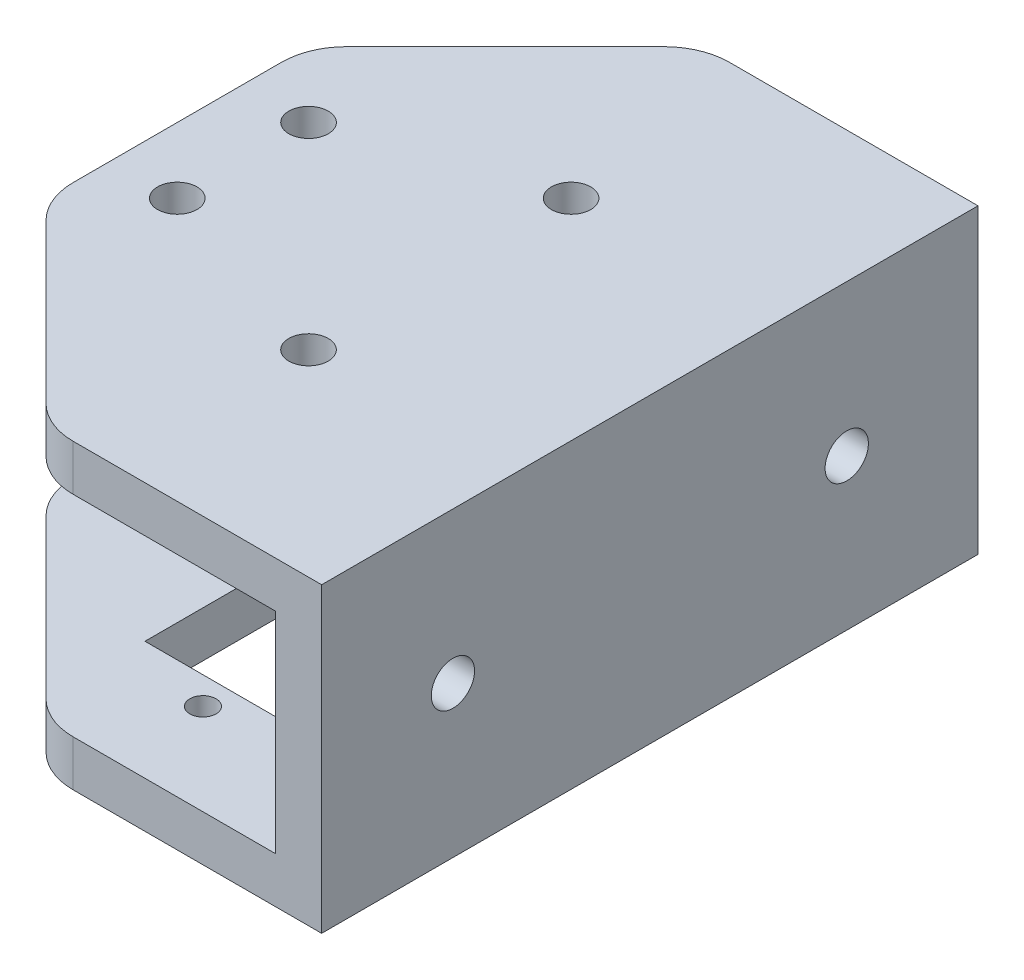
from build123d import *

# Parameters (mm, degrees)
EXTRUDE_1_DEPTH     = 50
CUT_EXTRUDE_START   = -19.5
SKETCH_2_R          = 1.5
CUT_EXTRUDE_1_DEPTH = 70
SKETCH_3_OUTSIDE_W  = 61.218
SKETCH_3_OUTSIDE_H  = 66.218
CUT_EXTRUDE_2_DEPTH = 70
SKETCH_2_3_R        = 1.5
CUT_EXTRUDE_4_DEPTH = 10
SKETCH_5_R          = 1
CUT_EXTRUDE_5_DEPTH = 10
FILLET_1_R          = 5
SKETCH_6_W          = 13
SKETCH_6_H          = 23.5
CUT_EXTRUDE_6_DEPTH = 10
SKETCH_7_R          = 1.65
CUT_EXTRUDE_7_DEPTH = 10


with BuildPart() as part:
    # 草图1 → 凸台-拉伸1 (new body)
    with BuildSketch(Plane.XY):
        Polygon((-45, 11.5), (0, 11.5), (0, -11.5), (-45, -11.5), (-45, -8), (-3.5, -8), (-3.5, 8), (-45, 8), align=None)
    extrude(amount=EXTRUDE_1_DEPTH)

    # 草图2 → 切除-拉伸1 (cut)
    with BuildSketch(Plane.XZ.offset(11.5).offset(CUT_EXTRUDE_START)):
        with Locations(Location((-16, 35, 0), (0, 0, 270))):
            Circle(SKETCH_2_R)
        with Locations(Location((-16, 15, 0), (0, 0, 270))):
            Circle(SKETCH_2_R)
        with Locations(Location((-31, 30, 0), (0, 0, 270))):
            Circle(SKETCH_2_R)
        with Locations(Location((-31, 20, 0), (0, 0, 270))):
            Circle(SKETCH_2_R)
    extrude(amount=-CUT_EXTRUDE_1_DEPTH, mode=Mode.SUBTRACT)

    # 草图3 outside → 切除-拉伸2 (cut)
    with BuildSketch(Plane.XZ.offset(11.5)):
        with Locations((-22.5, 25)):
            Rectangle(SKETCH_3_OUTSIDE_W, SKETCH_3_OUTSIDE_H)
        Polygon((-21, 0), (-36, 15), (-36, 35), (-21, 50), (0, 50), (0, 0), align=None, mode=Mode.SUBTRACT)
    extrude(amount=-CUT_EXTRUDE_2_DEPTH, mode=Mode.SUBTRACT)

    # 草图2<3> → 切除-拉伸4 (cut)
    with BuildSketch(Plane.XZ.offset(11.5)):
        with Locations(Location((-31, 30, 0), (0, 0, 270))):
            Circle(SKETCH_2_3_R)
        with Locations(Location((-31, 20, 0), (0, 0, 270))):
            Circle(SKETCH_2_3_R)
    extrude(amount=-CUT_EXTRUDE_4_DEPTH, mode=Mode.SUBTRACT)

    # 草图5 → 切除-拉伸5 (cut)
    with BuildSketch(Plane.XZ.offset(11.5)):
        with Locations(Location((-16, 43.045, 0), (0, 0, 270))):
            Circle(SKETCH_5_R)
        with Locations(Location((-16, 15.375, 0), (0, 0, 270))):
            Circle(SKETCH_5_R)
    extrude(amount=-CUT_EXTRUDE_5_DEPTH, mode=Mode.SUBTRACT)

    # 圆角1
    fillet_1_edges = [part.edges().sort_by_distance(p)[0] for p in [
        (-21, -9.75, 0),
        (-21, 9.75, 0),
        (-21, -9.75, 50),
        (-21, 9.75, 50),
        (-36, 9.75, 35),
        (-36, -9.75, 35),
        (-36, 9.75, 15),
        (-36, -9.75, 15),
    ]]
    fillet(fillet_1_edges, radius=FILLET_1_R)

    # 草图6 → 切除-拉伸6 (cut)
    with BuildSketch(Plane.XZ.offset(11.5)):
        with Locations((-16, 29.21)):
            Rectangle(SKETCH_6_W, SKETCH_6_H)
    extrude(amount=-CUT_EXTRUDE_6_DEPTH, mode=Mode.SUBTRACT)

    # 草图7 → 切除-拉伸7 (cut)
    with BuildSketch(Plane(origin=(0, 0, 0), x_dir=(0, 0, -1), z_dir=(1, 0, 0))):
        with Locations((-10, 0)):
            Circle(SKETCH_7_R)
        with Locations((-40, 0)):
            Circle(SKETCH_7_R)
    extrude(amount=-CUT_EXTRUDE_7_DEPTH, mode=Mode.SUBTRACT)


solid = part.part
